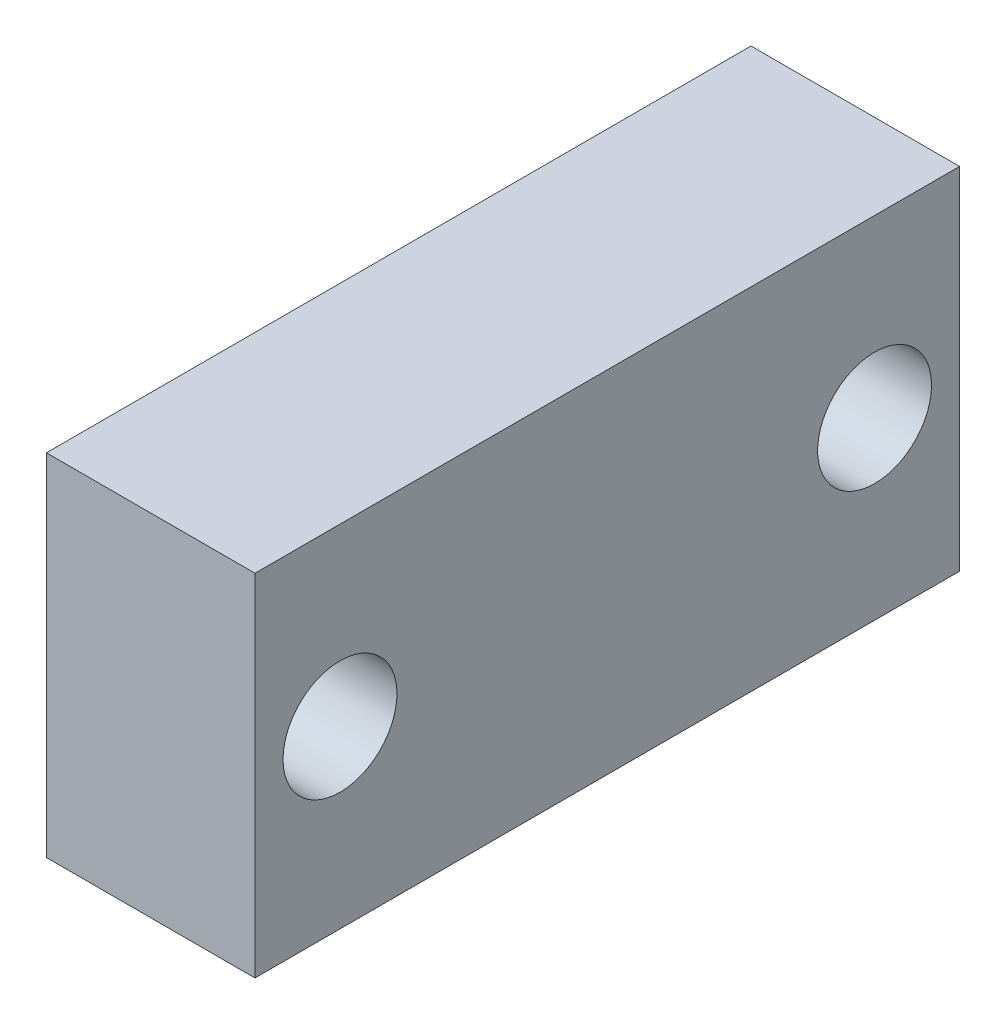
from build123d import *

# Parameters (mm, degrees)
SKETCH1_W           = 40.2
SKETCH1_H           = 20
BOSS_EXTRUDE1_DEPTH = 11.9
SKETCH2_R           = 2.35
CUT_EXTRUDE1_DEPTH  = 10
SKETCH3_R           = 2
CUT_EXTRUDE3_DEPTH  = 26.409053505
SKETCH5_R           = 3.25
CUT_EXTRUDE4_DEPTH  = 9
CHAMFER1_SIZE       = 1


with BuildPart() as part:
    # Sketch1 → Boss-Extrude1 (new body)
    with BuildSketch(Plane(origin=(0, 0, 0), x_dir=(0, 0, -1), z_dir=(1, 0, 0))):
        Rectangle(SKETCH1_W, SKETCH1_H)
    extrude(amount=BOSS_EXTRUDE1_DEPTH)

    # Sketch2 → Cut-Extrude1 (cut)
    with BuildSketch(Plane.XZ.offset(10)):
        with Locations(Location((3.89, -4.9, 0), (0, 0, 270))):
            Circle(SKETCH2_R)
        with Locations(Location((3.89, 4.9, 0), (0, 0, 90))):
            Circle(SKETCH2_R)
    extrude(amount=-CUT_EXTRUDE1_DEPTH, mode=Mode.SUBTRACT)

    # Sketch3 → Cut-Extrude3 (cut, through all)
    with BuildSketch(Plane(origin=(11.9, 0, 0), x_dir=(0, 0, -1), z_dir=(1, 0, 0))):
        with Locations((15.25, 0)):
            Circle(SKETCH3_R)
        with Locations(Location((-15.25, 0, 0), (0, 0, 180))):
            Circle(SKETCH3_R)
    extrude(amount=-CUT_EXTRUDE3_DEPTH, mode=Mode.SUBTRACT)

    # Sketch5 → Cut-Extrude4 (cut)
    with BuildSketch(Plane(origin=(11.9, 0, 0), x_dir=(0, 0, -1), z_dir=(1, 0, 0))):
        with Locations((15.25, 0)):
            Circle(SKETCH5_R)
        with Locations(Location((-15.25, 0, 0), (0, 0, 180))):
            Circle(SKETCH5_R)
    extrude(amount=-CUT_EXTRUDE4_DEPTH, mode=Mode.SUBTRACT)

    # Chamfer1
    chamfer1_edges = [part.edges().sort_by_distance(p)[0] for p in [
        (3.89, -10, -2.55),
        (3.89, -10, 2.55),
    ]]
    chamfer(chamfer1_edges, length=CHAMFER1_SIZE)


solid = part.part
